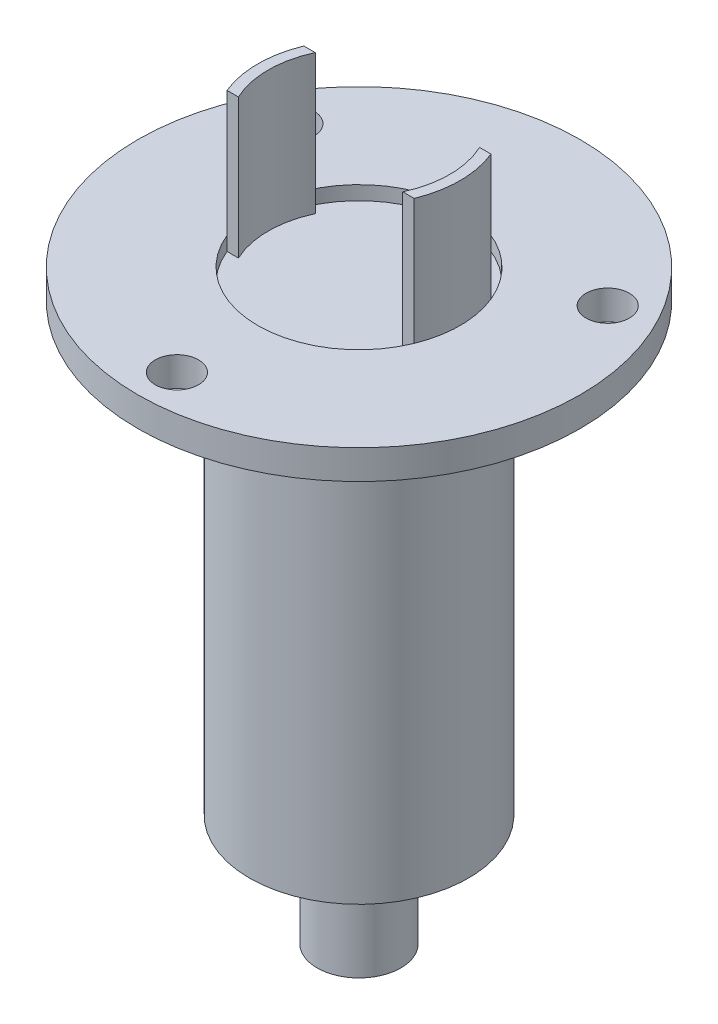
from build123d import *

# Parameters (mm, degrees)
SKETCH_1_W               = 3
SKETCH_1_H               = 8
SKETCH_2_R               = 7.25
CUT_EXTRUDE_1_DEPTH      = 1
EXTRUDE_START            = 10
EXTRUDE_1_DEPTH          = 10
CUT_EXTRUDE_2_DEPTH      = 48.607194834
CUT_EXTRUDE_2_DEPTH_BACK = 48.607194834
SKETCH_4_R               = 1.55


with BuildPart() as part:
    # 草图1 → 旋转1 (revolve)
    with BuildSketch(Plane.XY, mode=Mode.PRIVATE) as revolve_1_sk:
        Polygon((0, 42), (0, 39.9), (7.85, 39.9), (15.85, 39.9), (15.85, 42), align=None)
        Polygon((0, 39.9), (0, 8), (3, 8), (7.85, 8), (7.85, 39.9), align=None)
        with Locations((1.5, 4)):
            Rectangle(SKETCH_1_W, SKETCH_1_H)
    revolve(revolve_1_sk.sketch.rotate(Axis((0, 0, 0), (0, 1, 0)), 90), axis=Axis((0, 0, 0), (0, 1, 0)))

    # 草图2 → 切除-拉伸1 (cut)
    with BuildSketch(Plane(origin=(0, 42, 0), x_dir=(1, 0, 0), z_dir=(0, 1, 0))):
        with Locations(Location((0, 0, 0), (0, 0, 270))):
            Circle(SKETCH_2_R)
    extrude(amount=-CUT_EXTRUDE_1_DEPTH, mode=Mode.SUBTRACT)

    # 草图3 → 凸台-拉伸1 (add)
    with BuildSketch(Plane(origin=(0, 41, 0), x_dir=(1, 0, 0), z_dir=(0, 1, 0)).offset(EXTRUDE_START)):
        with BuildLine():
            Line((-5.888377744, 2.752636472), (-6.707122517, 2.752636472))
            ThreePointArc((-6.707122517, 2.752636472), (-7.25, 0), (-6.707122517, -2.752636472))
            Line((-6.707122517, -2.752636472), (-5.888377744, -2.752636472))
            ThreePointArc((-5.888377744, -2.752636472), (-6.5, 0), (-5.888377744, 2.752636472))
        make_face()
        with BuildLine():
            ThreePointArc((7.25, 0), (7.11298595, 1.402829597), (6.707122517, 2.752636472))
            Line((6.707122517, 2.752636472), (5.888377744, 2.752636472))
            ThreePointArc((5.888377744, 2.752636472), (6.345252372, 1.409883801), (6.5, 0))
            ThreePointArc((6.5, 0), (6.345252372, -1.409883801), (5.888377744, -2.752636472))
            Line((5.888377744, -2.752636472), (6.707122517, -2.752636472))
            ThreePointArc((6.707122517, -2.752636472), (7.11298595, -1.402829597), (7.25, 0))
        make_face()
    extrude(amount=-EXTRUDE_1_DEPTH)

    # 草图4 → 切除-拉伸2 (cut, two sides: drawn at the far end of the back side and taken through both)
    with BuildSketch(Plane(origin=(0, 42, 0), x_dir=(1, 0, 0), z_dir=(0, 1, 0)).offset(-CUT_EXTRUDE_2_DEPTH_BACK)):
        with Locations(Location((0, -13.05, 0), (0, 0, 270))):
            Circle(SKETCH_4_R)
        with Locations(Location((-11.301631519, 6.525, 0), (0, 0, 270))):
            Circle(SKETCH_4_R)
        with Locations(Location((11.301631519, 6.525, 0), (0, 0, 270))):
            Circle(SKETCH_4_R)
    extrude(amount=CUT_EXTRUDE_2_DEPTH + CUT_EXTRUDE_2_DEPTH_BACK, mode=Mode.SUBTRACT)


solid = part.part
